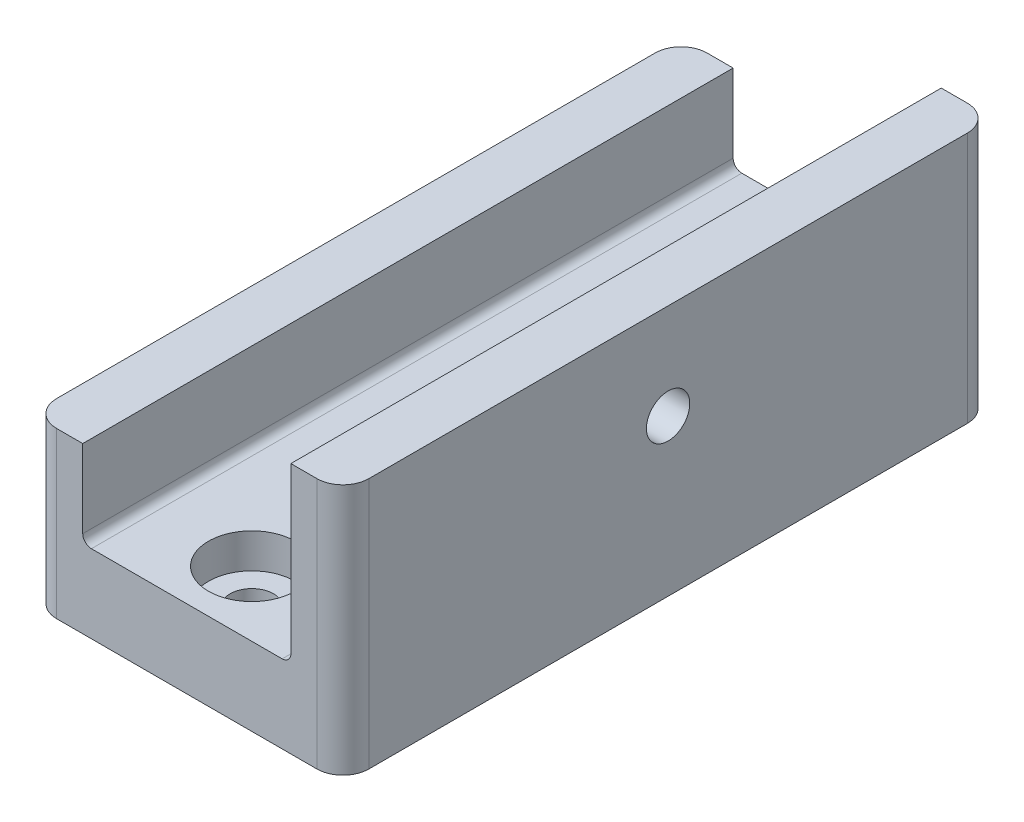
from build123d import *

# Parameters (mm, degrees)
SKETCH1_W           = 24
SKETCH1_H           = 9
BOSS_EXTRUDE1_DEPTH = 75
FILLET1_R           = 1
FILLET2_R           = 3
SKETCH2_R           = 2.5
CUT_EXTRUDE1_DEPTH  = 6
SKETCH3_R           = 2.5
CUT_EXTRUDE2_DEPTH  = 10
SKETCH4_R           = 5
CUT_EXTRUDE3_DEPTH  = 4


with BuildPart() as part:
    # Sketch1 → Boss-Extrude1 (new body)
    with BuildSketch(Plane.XY):
        Polygon((-18, -4.5), (-12, -4.5), (-12, 4.5), (-12, 14.5), (-18, 14.5), align=None)
        Rectangle(SKETCH1_W, SKETCH1_H)
        Polygon((12, 4.5), (12, -4.5), (18, -4.5), (18, 24.5), (12, 24.5), align=None)
    extrude(amount=BOSS_EXTRUDE1_DEPTH)

    # Fillet1
    fillet1_edges = [part.edges().sort_by_distance(p)[0] for p in [
        (-12, 4.5, 37.5),
        (12, 4.5, 37.5),
    ]]
    fillet(fillet1_edges, radius=FILLET1_R)

    # Fillet2
    fillet2_edges = [part.edges().sort_by_distance(p)[0] for p in [
        (18, 10, 0),
        (-18, 5, 0),
        (18, 10, 75),
        (-18, 5, 75),
    ]]
    fillet(fillet2_edges, radius=FILLET2_R)

    # Sketch2 → Cut-Extrude1 (cut)
    with BuildSketch(Plane.ZY.offset(-12)):
        with Locations((37.5, 13.5)):
            Circle(SKETCH2_R)
    extrude(amount=-CUT_EXTRUDE1_DEPTH, mode=Mode.SUBTRACT)

    # Sketch3 → Cut-Extrude2 (cut)
    with BuildSketch(Plane(origin=(0, 4.5, 0), x_dir=(1, 0, 0), z_dir=(0, 1, 0))):
        with Locations(Location((0, -37.5, 0), (0, 0, 270))):
            Circle(SKETCH3_R)
        with Locations(Location((0, -7.5, 0), (0, 0, 270))):
            Circle(SKETCH3_R)
        with Locations(Location((0, -67.5, 0), (0, 0, 270))):
            Circle(SKETCH3_R)
    extrude(amount=-CUT_EXTRUDE2_DEPTH, mode=Mode.SUBTRACT)

    # Sketch4 → Cut-Extrude3 (cut)
    with BuildSketch(Plane(origin=(0, 4.5, 0), x_dir=(1, 0, 0), z_dir=(0, 1, 0))):
        with Locations(Location((0, -7.5, 0), (0, 0, 270))):
            Circle(SKETCH4_R)
        with Locations(Location((0, -37.5, 0), (0, 0, 270))):
            Circle(SKETCH4_R)
        with Locations(Location((0, -67.5, 0), (0, 0, 270))):
            Circle(SKETCH4_R)
    extrude(amount=-CUT_EXTRUDE3_DEPTH, mode=Mode.SUBTRACT)


solid = part.part
